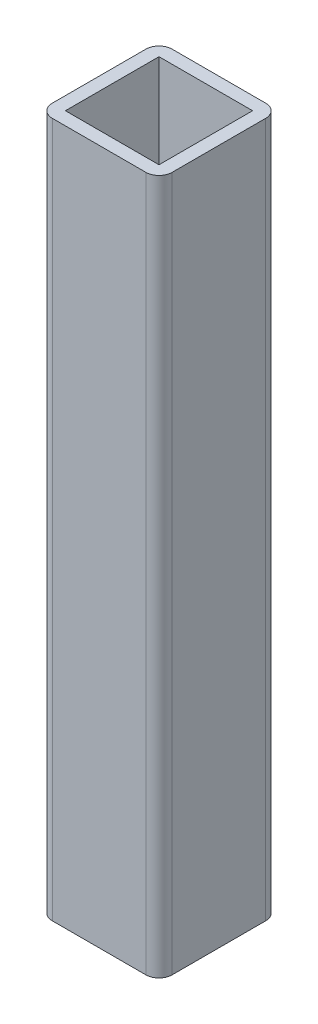
from build123d import *

# Parameters (mm, degrees)
BOSS_EXTRUDE1_DEPTH = 148.5
SKETCH3_W           = 20
SKETCH3_H           = 20
CUT_EXTRUDE1_DEPTH  = 148.5


with BuildPart() as part:
    # Sketch1 → Boss-Extrude1 (new body)
    with BuildSketch(Plane(origin=(0, 0, 0), x_dir=(1, 0, 0), z_dir=(0, 1, 0))):
        with BuildLine():
            Line((2.8, 0), (22.8, 0))
            ThreePointArc((22.8, 0), (24.779898987, -0.820101013), (25.6, -2.8))
            Line((25.6, -2.8), (25.6, -22.8))
            ThreePointArc((25.6, -22.8), (24.779898987, -24.779898987), (22.8, -25.6))
            Line((22.8, -25.6), (2.8, -25.6))
            ThreePointArc((2.8, -25.6), (0.820101013, -24.779898987), (0, -22.8))
            Line((0, -22.8), (0, -2.8))
            ThreePointArc((0, -2.8), (0.820101013, -0.820101013), (2.8, 0))
        make_face()
    extrude(amount=BOSS_EXTRUDE1_DEPTH)

    # Sketch3 → Cut-Extrude1 (cut)
    with BuildSketch(Plane(origin=(0, 0, 0), x_dir=(-1, 0, 0), z_dir=(0, -1, 0))):
        with Locations((-12.8, -12.8)):
            Rectangle(SKETCH3_W, SKETCH3_H)
    extrude(amount=-CUT_EXTRUDE1_DEPTH, mode=Mode.SUBTRACT)


solid = part.part
